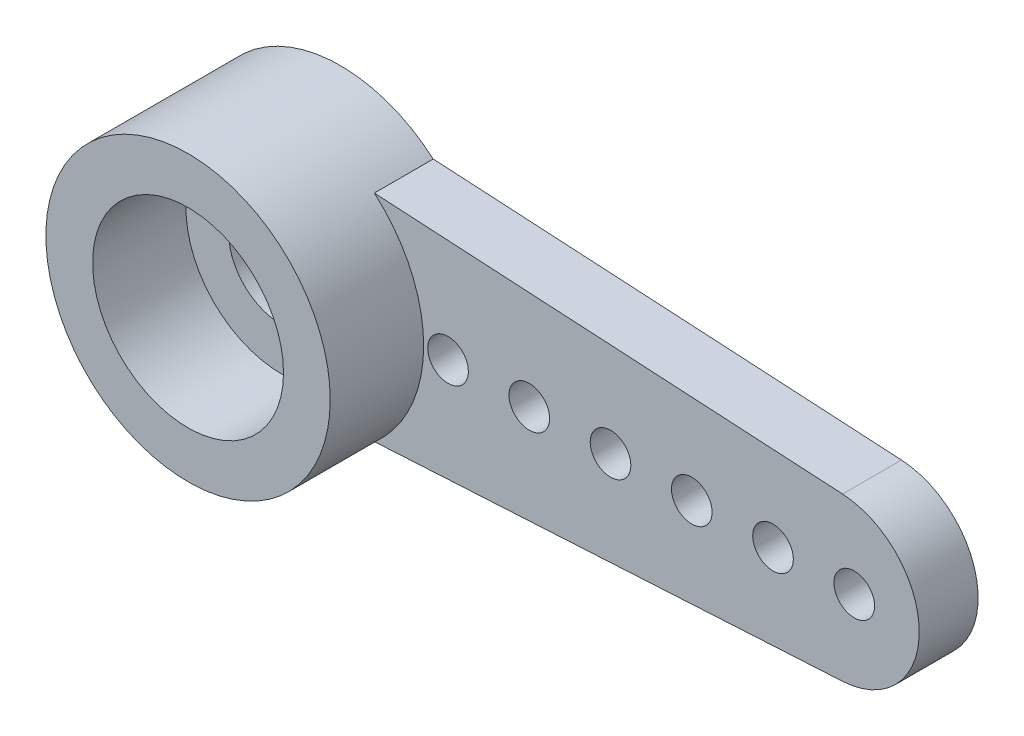
from build123d import *

# Parameters (mm, degrees)
SKETCH_1_R             = 2.775112647
SKETCH_1_R_2           = 2
SKETCH_1_R_3           = 3.5
EXTRUDE_1_DEPTH        = 1.45
SKETCH_2_R             = 3.5
SKETCH_2_R_2           = 2.35
EXTRUDE_2_DEPTH        = 2.3
SKETCH_3_R             = 2.3
CUT_EXTRUDE_1_DEPTH    = 0.7
SKETCH_4_R             = 1.3
CUT_EXTRUDE_2_DEPTH    = 17.372003543
SKETCH_5_R             = 0.5
CUT_EXTRUDE_3_DEPTH    = 17.516733939
PATTERN_LINEAR_1_COUNT = 6
PATTERN_LINEAR_1_PITCH = 2


with BuildPart() as part:
    # 草图1 → 凸台-拉伸1 (new body)
    with BuildSketch(Plane.XY):
        with BuildLine():
            Line((0.157009161, 2.770667488), (-1.972354438, 2.891334981))
            ThreePointArc((-1.972354438, 2.891334981), (-3.5, 0), (-1.972354438, -2.891334981))
            Line((-1.972354438, -2.891334981), (0.1570091, -2.770667491))
            ThreePointArc((0.1570091, -2.770667491), (-2.775112647, 3.1e-08), (0.157009161, 2.770667488))
        make_face()
        with BuildLine():
            Line((2.286372673, 2.65), (0.157009161, 2.770667488))
            ThreePointArc((0.157009161, 2.770667488), (2.017048378, 1.905981649), (2.775112647, 0))
            ThreePointArc((2.775112647, 0), (2.017048356, -1.905981672), (0.1570091, -2.770667491))
            Line((0.1570091, -2.770667491), (2.286372673, -2.65))
            ThreePointArc((2.286372673, -2.65), (3.182161557, -1.457342726), (3.5, 0))
            ThreePointArc((3.5, 0), (3.182161557, 1.457342726), (2.286372673, 2.65))
        make_face()
        Circle(SKETCH_1_R)
        with BuildLine():
            ThreePointArc((2.286372673, 2.65), (0.198021479, 3.494393723), (-1.972354438, 2.891334981))
            Line((-1.972354438, 2.891334981), (0.157009161, 2.770667488))
            Line((0.157009161, 2.770667488), (2.286372673, 2.65))
        make_face()
        with BuildLine():
            Line((0.1570091, -2.770667491), (-1.972354438, -2.891334981))
            ThreePointArc((-1.972354438, -2.891334981), (0.198021479, -3.494393723), (2.286372673, -2.65))
            Line((2.286372673, -2.65), (0.1570091, -2.770667491))
        make_face()
        with BuildLine():
            Line((13.813155138, 1.996796413), (2.286372673, 2.65))
            ThreePointArc((2.286372673, 2.65), (3.182161557, 1.457342726), (3.5, 0))
            ThreePointArc((3.5, 0), (3.182161557, -1.457342726), (2.286372673, -2.65))
            Line((2.286372673, -2.65), (13.813155123, -1.996796414))
            ThreePointArc((13.813155123, -1.996796414), (11.7, 8e-09), (13.813155138, 1.996796413))
        make_face()
        with Locations((13.7, 0)):
            Circle(SKETCH_1_R_2)
        Circle(SKETCH_1_R_3)
    extrude(amount=EXTRUDE_1_DEPTH)

    # 草图2 → 凸台-拉伸2 (add)
    with BuildSketch(Plane.XY.offset(1.45)):
        with Locations(Location((0, 0, 0), (0, 0, 310.787038193))):
            Circle(SKETCH_2_R)
        Circle(SKETCH_2_R_2, mode=Mode.SUBTRACT)
    extrude(amount=EXTRUDE_2_DEPTH)

    # 草图3 → 切除-拉伸1 (cut)
    with BuildSketch(Plane(origin=(0, 0, 0), x_dir=(-1, 0, 0), z_dir=(0, 0, -1))):
        Circle(SKETCH_3_R)
    extrude(amount=-CUT_EXTRUDE_1_DEPTH, mode=Mode.SUBTRACT)

    # 草图4 → 切除-拉伸2 (cut, through all)
    with BuildSketch(Plane(origin=(0, 0, 0.7), x_dir=(-1, 0, 0), z_dir=(0, 0, -1))):
        Circle(SKETCH_4_R)
    extrude(amount=-CUT_EXTRUDE_2_DEPTH, mode=Mode.SUBTRACT)

    # 草图5 → 切除-拉伸3 (cut, through all)
    with BuildSketch(Plane(origin=(0, 0, 0), x_dir=(-1, 0, 0), z_dir=(0, 0, -1))):
        with Locations((-14.1, 0)):
            Circle(SKETCH_5_R)
    cut_extrude_3 = extrude(amount=-CUT_EXTRUDE_3_DEPTH, mode=Mode.SUBTRACT)

    # 阵列(线性)1: 切除-拉伸3 ×6
    with Locations(*[(-i * PATTERN_LINEAR_1_PITCH, 0, 0) for i in range(1, PATTERN_LINEAR_1_COUNT)]):
        add(cut_extrude_3, mode=Mode.SUBTRACT)


solid = part.part
